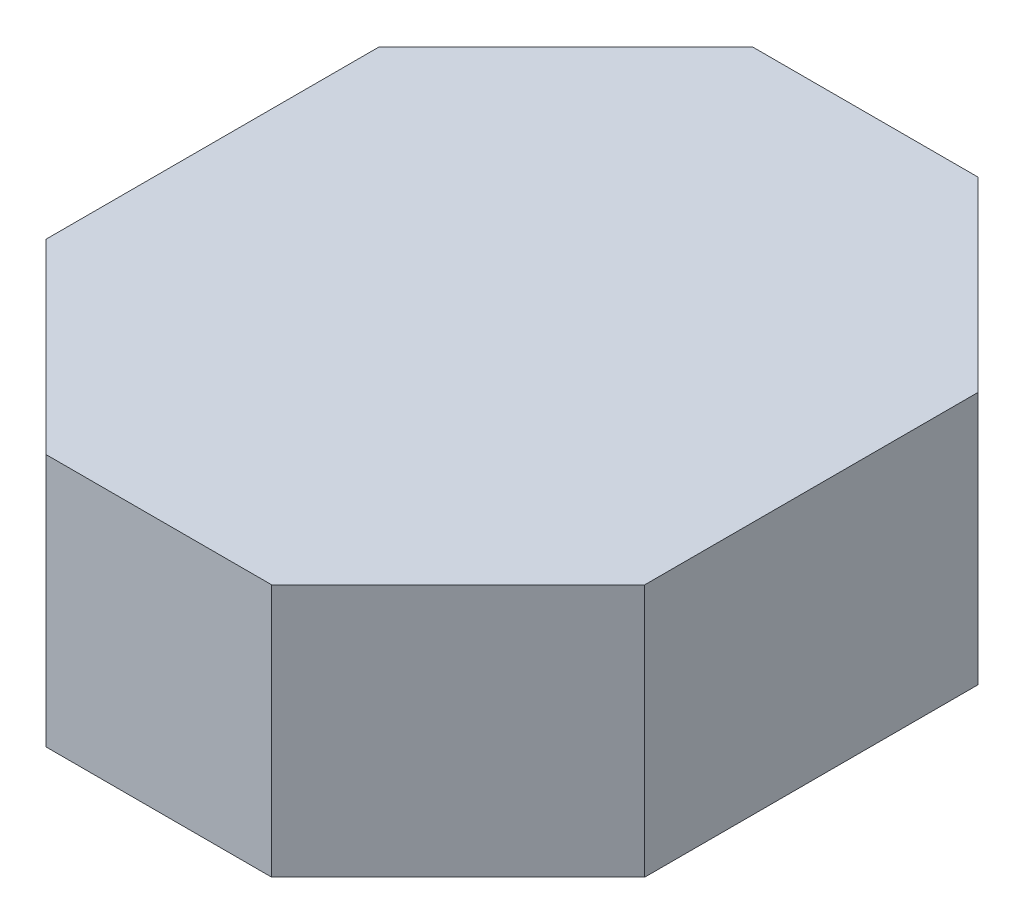
from build123d import *

# Parameters (mm, degrees)
EXTRUDE_3_DEPTH     = 80
CUT_EXTRUDE_1_DEPTH = 78


with BuildPart() as part:
    # 草图1 → 凸台-拉伸3 (new body)
    with BuildSketch(Plane(origin=(0, 0, 0), x_dir=(1, 0, 0), z_dir=(0, 1, 0))):
        Polygon((-1.656854249, 4), (69.656854249, 4), (128.568542495, -54.911688245), (128.568542495, -160.225396744), (69.656854249, -219.13708499), (-1.656854249, -219.13708499), (-60.568542495, -160.225396744), (-60.568542495, -54.911688245), align=None)
    extrude(amount=EXTRUDE_3_DEPTH)

    # 草图1<6> → 切除-拉伸1 (cut)
    with BuildSketch(Plane(origin=(0, 0, 0), x_dir=(1, 0, 0), z_dir=(0, 1, 0))):
        Polygon((-58.568542495, -55.74011537), (-0.828427125, 2), (68.828427125, 2), (126.568542495, -55.74011537), (126.568542495, -159.39696962), (68.828427125, -217.13708499), (-0.828427125, -217.13708499), (-58.568542495, -159.39696962), align=None)
    extrude(amount=CUT_EXTRUDE_1_DEPTH, mode=Mode.SUBTRACT)


solid = part.part
